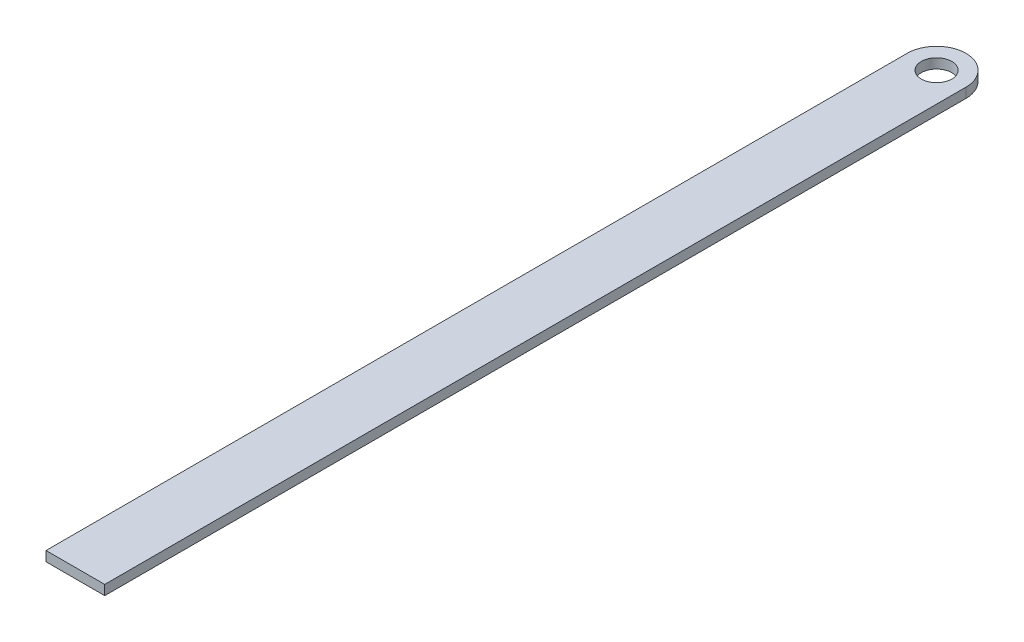
from build123d import *

# Parameters (mm, degrees)
SKETCH1_R           = 2.4765
BOSS_EXTRUDE1_DEPTH = 1.5875


with BuildPart() as part:
    # Sketch1 → Boss-Extrude1 (new body)
    with BuildSketch(Plane(origin=(0, 0, 0), x_dir=(1, 0, 0), z_dir=(0, 1, 0))):
        with BuildLine():
            Line((0, 0), (0, -139.7))
            Line((0, -139.7), (9.525, -139.7))
            Line((9.525, -139.7), (9.525, 0))
            ThreePointArc((9.525, 0), (4.7625, 4.7625), (0, 0))
        make_face()
        with Locations(Location((4.7625, 0, 0), (0, 0, 270))):
            Circle(SKETCH1_R, mode=Mode.SUBTRACT)
    extrude(amount=BOSS_EXTRUDE1_DEPTH)


solid = part.part
